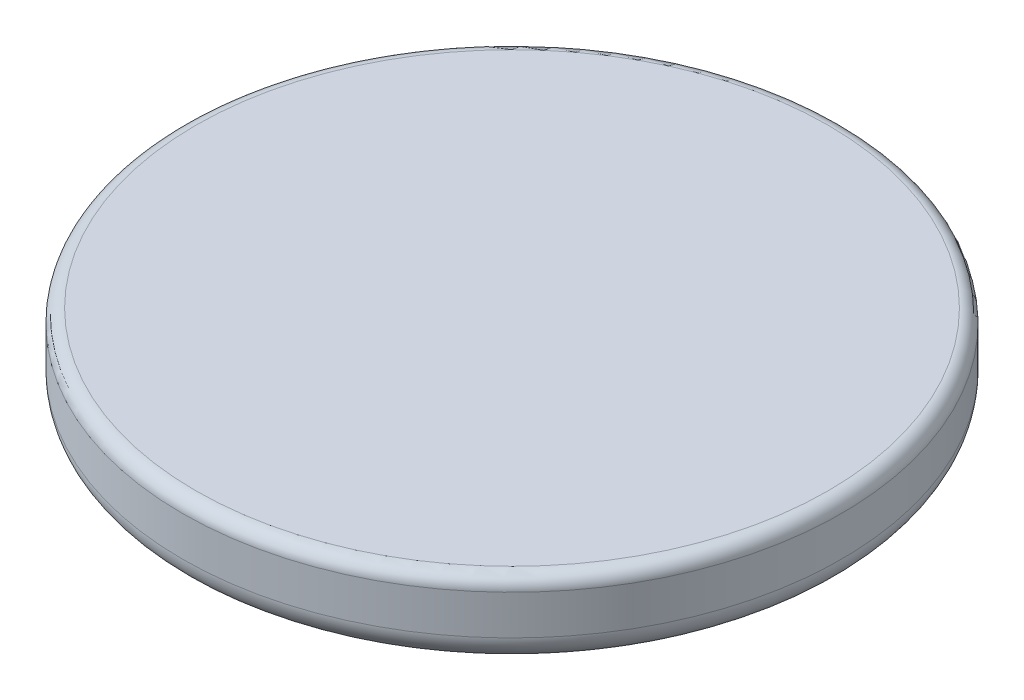
from build123d import *

# Parameters (mm, degrees)
SKETCH1_R           = 31.75
BOSS_EXTRUDE1_DEPTH = 7.62
SKETCH2_R           = 3.683
BOSS_EXTRUDE2_DEPTH = 12.7
FILLET1_R           = 1.27
FILLET2_R           = 2.54


with BuildPart() as part:
    # Sketch1 → Boss-Extrude1 (new body)
    with BuildSketch(Plane(origin=(0, 0, 0), x_dir=(1, 0, 0), z_dir=(0, 1, 0))):
        with Locations(Location((0, 0, 0), (0, 0, 90))):
            Circle(SKETCH1_R)
    extrude(amount=BOSS_EXTRUDE1_DEPTH)

    # Sketch2 → Boss-Extrude2 (add)
    with BuildSketch(Plane.XZ):
        with Locations(Location((0, 0, 0), (0, 0, 90))):
            Circle(SKETCH2_R)
    extrude(amount=BOSS_EXTRUDE2_DEPTH)

    # Fillet1
    fillet1_edges = [part.edges().sort_by_distance(p)[0] for p in [
        (0, 7.62, 31.75),
    ]]
    fillet(fillet1_edges, radius=FILLET1_R)

    # Fillet2
    fillet2_edges = [part.edges().sort_by_distance(p)[0] for p in [
        (0, 0, 31.75),
    ]]
    fillet(fillet2_edges, radius=FILLET2_R)


solid = part.part
